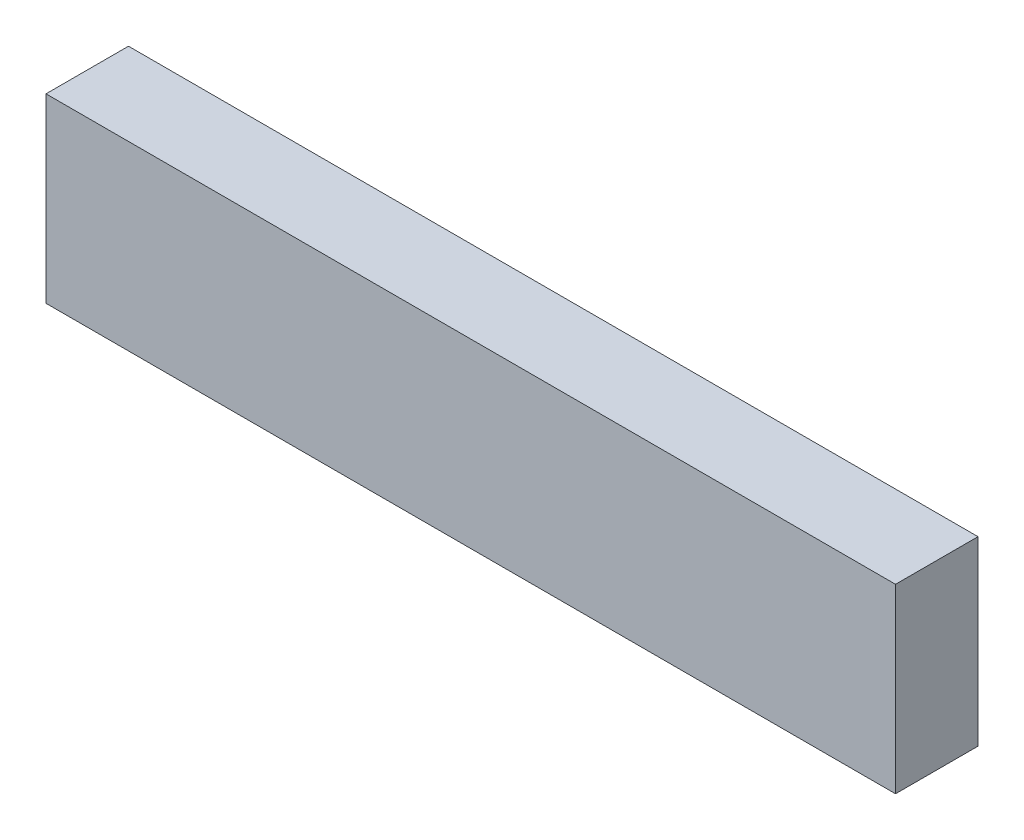
from build123d import *

# Parameters (mm, degrees)
SKETCH_1_W      = 51.5
SKETCH_1_H      = 5
EXTRUDE_1_DEPTH = 11


with BuildPart() as part:
    # Эскиз1 → Бобышка-Вытянуть1 (new body)
    with BuildSketch(Plane(origin=(0, 0, 0), x_dir=(1, 0, 0), z_dir=(0, 1, 0))):
        Rectangle(SKETCH_1_W, SKETCH_1_H)
    extrude(amount=EXTRUDE_1_DEPTH)


solid = part.part
